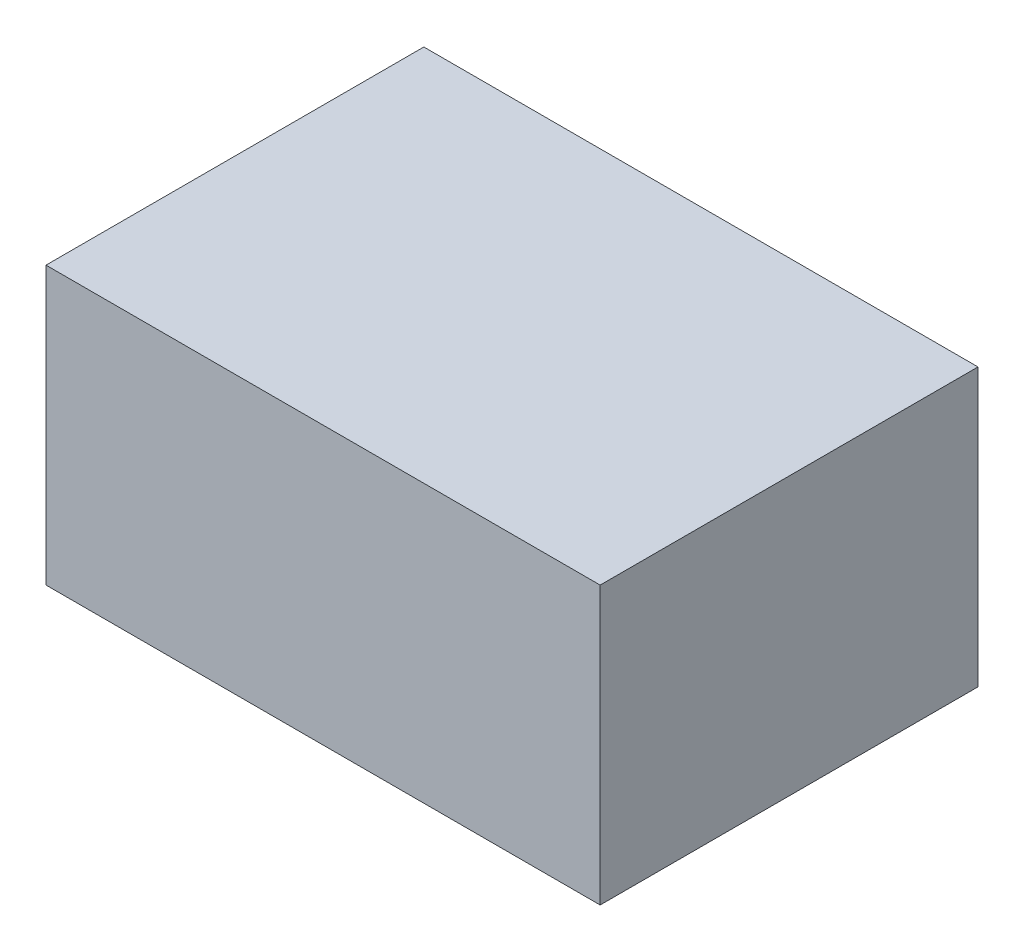
from build123d import *

# Parameters (mm, degrees)
SKETCH1_W           = 279.4
SKETCH1_H           = 139.7
BOSS_EXTRUDE1_DEPTH = 190.5


with BuildPart() as part:
    # Sketch1 → Boss-Extrude1 (new body)
    with BuildSketch(Plane.XY):
        with Locations((139.7, 69.85)):
            Rectangle(SKETCH1_W, SKETCH1_H)
    extrude(amount=BOSS_EXTRUDE1_DEPTH)


solid = part.part
